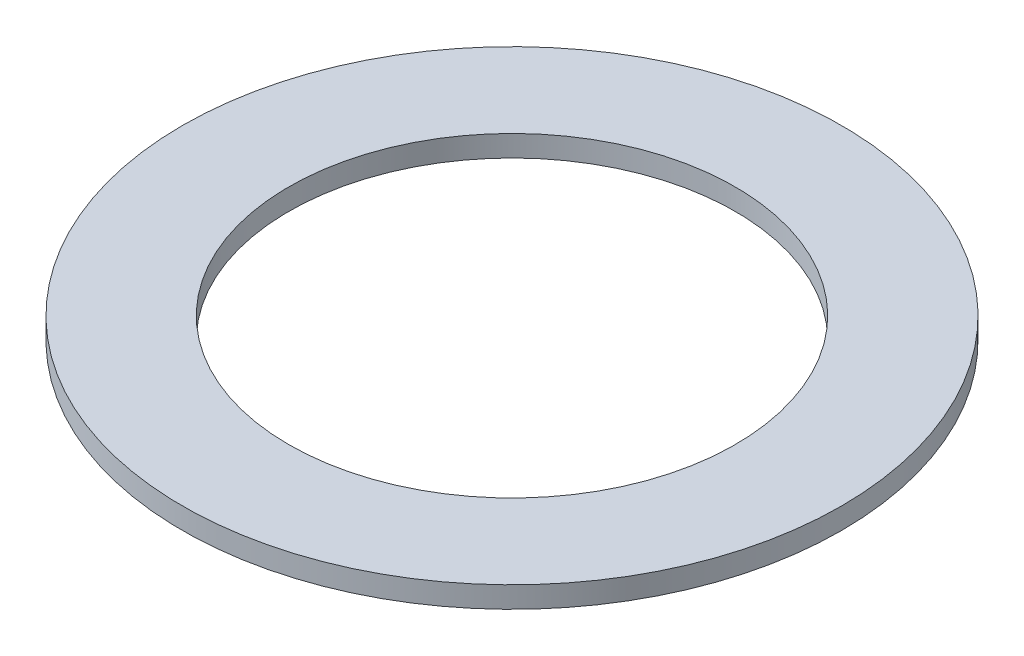
from build123d import *

# Parameters (mm, degrees)
SKETCH1_R           = 15.5
SKETCH1_R_2         = 10.5
EXTRUDE_THIN1_DEPTH = 1


with BuildPart() as part:
    # Sketch1 → Extrude-Thin1 (new body)
    with BuildSketch(Plane(origin=(0, 0, 0), x_dir=(1, 0, 0), z_dir=(0, 1, 0))):
        Circle(SKETCH1_R)
        Circle(SKETCH1_R_2, mode=Mode.SUBTRACT)
    extrude(amount=EXTRUDE_THIN1_DEPTH)


solid = part.part
